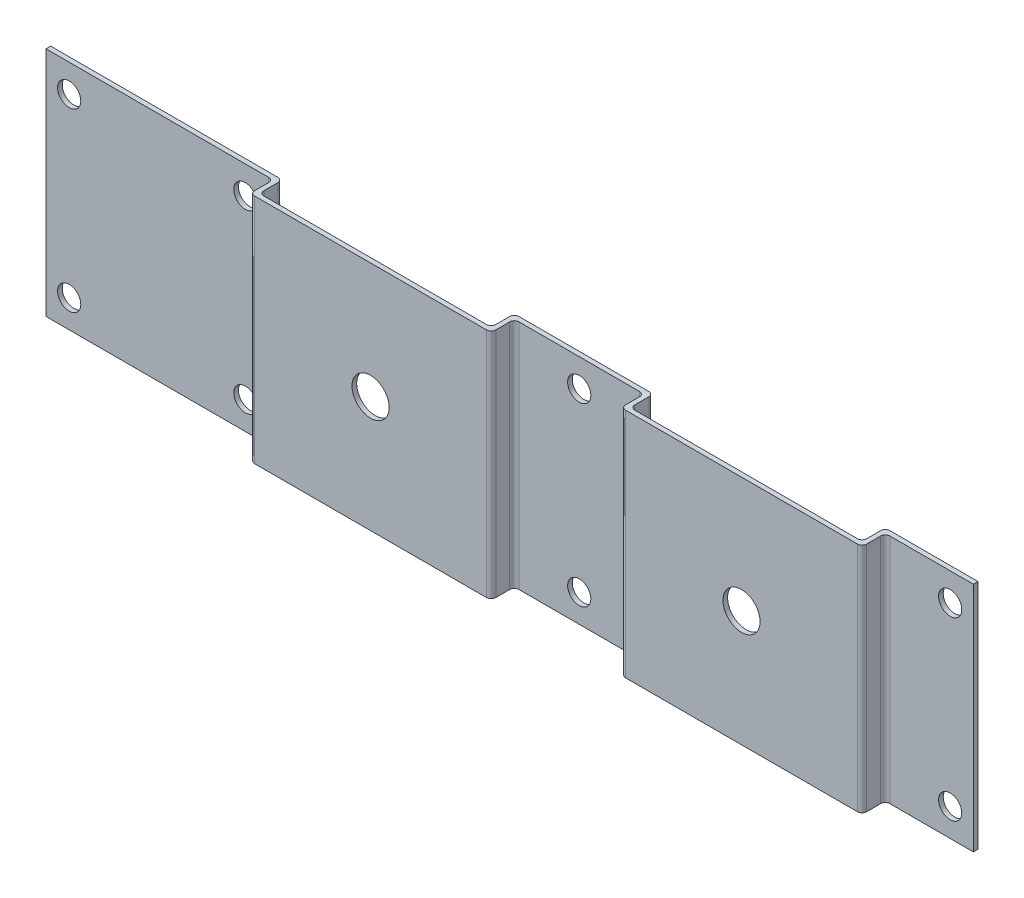
from build123d import *

# Parameters (mm, degrees)
SKETCH1_W           = 50
SKETCH1_H           = 50
BOSS_EXTRUDE1_DEPTH = 1
BOSS_EXTRUDE2_START = 5
SKETCH2_W           = 50
SKETCH2_H           = 50
BOSS_EXTRUDE2_DEPTH = 1
SKETCH3_W           = 30
SKETCH3_H           = 50
BOSS_EXTRUDE3_DEPTH = 1
BOSS_EXTRUDE4_START = 5
SKETCH4_W           = 50
SKETCH4_H           = 50
BOSS_EXTRUDE4_DEPTH = 1
SKETCH5_W           = 20
SKETCH5_H           = 50
BOSS_EXTRUDE5_DEPTH = 1
SKETCH6_W           = 6
SKETCH6_H           = 50
BOSS_EXTRUDE6_DEPTH = 1
SKETCH7_W           = 6
SKETCH7_H           = 50
BOSS_EXTRUDE7_DEPTH = 1
SKETCH8_W           = 6
SKETCH8_H           = 50
BOSS_EXTRUDE8_DEPTH = 1
SKETCH9_W           = 6
SKETCH9_H           = 50
BOSS_EXTRUDE9_DEPTH = 1
FILLET1_R           = 1
FILLET2_R           = 1
FILLET3_R           = 1
FILLET4_R           = 1
FILLET5_R           = 1
FILLET6_R           = 1
FILLET7_R           = 1
FILLET8_R           = 1
FILLET9_R           = 1
FILLET10_R          = 1
FILLET11_R          = 1
FILLET12_R          = 1
FILLET13_R          = 1
FILLET14_R          = 1
FILLET15_R          = 1
FILLET16_R          = 1
SKETCH10_R          = 2.5
CUT_EXTRUDE1_DEPTH  = 1
SKETCH11_R          = 4
SKETCH11_R_2        = 2.5
CUT_EXTRUDE7_DEPTH  = 50.5


with BuildPart() as part:
    # Sketch1 → Boss-Extrude1 (new body)
    with BuildSketch(Plane.XY):
        Rectangle(SKETCH1_W, SKETCH1_H)
    extrude(amount=BOSS_EXTRUDE1_DEPTH)



with BuildPart() as body_2:
    # Sketch2 → Boss-Extrude2 (new body)
    with BuildSketch(Plane.XY.offset(BOSS_EXTRUDE2_START)):
        with Locations((50, 0)):
            Rectangle(SKETCH2_W, SKETCH2_H)
    extrude(amount=BOSS_EXTRUDE2_DEPTH)


with BuildPart() as body_3:
    # Sketch3 → Boss-Extrude3 (new body)
    with BuildSketch(Plane.XY):
        with Locations((90, 0)):
            Rectangle(SKETCH3_W, SKETCH3_H)
    extrude(amount=BOSS_EXTRUDE3_DEPTH)


with BuildPart() as body_4:
    # Sketch4 → Boss-Extrude4 (new body)
    with BuildSketch(Plane.XY.offset(BOSS_EXTRUDE4_START)):
        with Locations((130, 0)):
            Rectangle(SKETCH4_W, SKETCH4_H)
    extrude(amount=BOSS_EXTRUDE4_DEPTH)


with BuildPart() as body_5:
    # Sketch5 → Boss-Extrude5 (new body)
    with BuildSketch(Plane.XY):
        with Locations((165, 0)):
            Rectangle(SKETCH5_W, SKETCH5_H)
    extrude(amount=BOSS_EXTRUDE5_DEPTH)


with BuildPart() as part_1:
    add(part.part)

    add(body_2.part)  # Boss-Extrude6 merges body 2
    # Sketch6 → Boss-Extrude6 (add)
    with BuildSketch(Plane.ZY.offset(-25)):
        with Locations((3, 0)):
            Rectangle(SKETCH6_W, SKETCH6_H)
    extrude(amount=BOSS_EXTRUDE6_DEPTH)


    add(body_3.part)  # Boss-Extrude7 merges body 3
    # Sketch7 → Boss-Extrude7 (add)
    with BuildSketch(Plane(origin=(75, 0, 0), x_dir=(0, 0, -1), z_dir=(1, 0, 0))):
        with Locations((-3, 0)):
            Rectangle(SKETCH7_W, SKETCH7_H)
    extrude(amount=BOSS_EXTRUDE7_DEPTH)


    add(body_4.part)  # Boss-Extrude8 merges body 4
    # Sketch8 → Boss-Extrude8 (add)
    with BuildSketch(Plane.ZY.offset(-105)):
        with Locations((3, 0)):
            Rectangle(SKETCH8_W, SKETCH8_H)
    extrude(amount=BOSS_EXTRUDE8_DEPTH)


    add(body_5.part)  # Boss-Extrude9 merges body 5
    # Sketch9 → Boss-Extrude9 (add)
    with BuildSketch(Plane(origin=(155, 0, 0), x_dir=(0, 0, -1), z_dir=(1, 0, 0))):
        with Locations((-3, 0)):
            Rectangle(SKETCH9_W, SKETCH9_H)
    extrude(amount=BOSS_EXTRUDE9_DEPTH)

    # Fillet1
    fillet1_edges = [part_1.edges().sort_by_distance(p)[0] for p in [
        (24, 0, 1),
    ]]
    fillet(fillet1_edges, radius=FILLET1_R)

    # Fillet2
    fillet2_edges = [part_1.edges().sort_by_distance(p)[0] for p in [
        (24, 0, 6),
    ]]
    fillet(fillet2_edges, radius=FILLET2_R)

    # Fillet3
    fillet3_edges = [part_1.edges().sort_by_distance(p)[0] for p in [
        (76, 0, 6),
    ]]
    fillet(fillet3_edges, radius=FILLET3_R)

    # Fillet4
    fillet4_edges = [part_1.edges().sort_by_distance(p)[0] for p in [
        (76, 0, 1),
    ]]
    fillet(fillet4_edges, radius=FILLET4_R)

    # Fillet5
    fillet5_edges = [part_1.edges().sort_by_distance(p)[0] for p in [
        (104, 0, 6),
    ]]
    fillet(fillet5_edges, radius=FILLET5_R)

    # Fillet6
    fillet6_edges = [part_1.edges().sort_by_distance(p)[0] for p in [
        (104, 0, 1),
    ]]
    fillet(fillet6_edges, radius=FILLET6_R)

    # Fillet7
    fillet7_edges = [part_1.edges().sort_by_distance(p)[0] for p in [
        (156, 0, 6),
    ]]
    fillet(fillet7_edges, radius=FILLET7_R)

    # Fillet8
    fillet8_edges = [part_1.edges().sort_by_distance(p)[0] for p in [
        (156, 0, 1),
    ]]
    fillet(fillet8_edges, radius=FILLET8_R)

    # Fillet9
    fillet9_edges = [part_1.edges().sort_by_distance(p)[0] for p in [
        (155, 0, 0),
    ]]
    fillet(fillet9_edges, radius=FILLET9_R)

    # Fillet10
    fillet10_edges = [part_1.edges().sort_by_distance(p)[0] for p in [
        (155, 0, 5),
    ]]
    fillet(fillet10_edges, radius=FILLET10_R)

    # Fillet11
    fillet11_edges = [part_1.edges().sort_by_distance(p)[0] for p in [
        (105, 0, 5),
    ]]
    fillet(fillet11_edges, radius=FILLET11_R)

    # Fillet12
    fillet12_edges = [part_1.edges().sort_by_distance(p)[0] for p in [
        (105, 0, 0),
    ]]
    fillet(fillet12_edges, radius=FILLET12_R)

    # Fillet13
    fillet13_edges = [part_1.edges().sort_by_distance(p)[0] for p in [
        (25, 0, 5),
    ]]
    fillet(fillet13_edges, radius=FILLET13_R)

    # Fillet14
    fillet14_edges = [part_1.edges().sort_by_distance(p)[0] for p in [
        (25, 0, 0),
    ]]
    fillet(fillet14_edges, radius=FILLET14_R)

    # Fillet15
    fillet15_edges = [part_1.edges().sort_by_distance(p)[0] for p in [
        (75, 0, 5),
    ]]
    fillet(fillet15_edges, radius=FILLET15_R)

    # Fillet16
    fillet16_edges = [part_1.edges().sort_by_distance(p)[0] for p in [
        (75, 0, 0),
    ]]
    fillet(fillet16_edges, radius=FILLET16_R)

    # Sketch10 → Cut-Extrude1 (cut)
    with BuildSketch(Plane.XY.offset(1)):
        with Locations((-20, 19)):
            Circle(SKETCH10_R)
        with Locations((-20, -19)):
            Circle(SKETCH10_R)
        with Locations((18, -19)):
            Circle(SKETCH10_R)
        with Locations((18, 19)):
            Circle(SKETCH10_R)
    extrude(amount=-CUT_EXTRUDE1_DEPTH, mode=Mode.SUBTRACT)

    # Sketch11 → Cut-Extrude7 (cut, symmetric)
    with BuildSketch(Plane.XY):
        with Locations(Location((50, 0, 0), (0, 0, 180))):
            Circle(SKETCH11_R)
        with Locations(Location((130, 0, 0), (0, 0, 180))):
            Circle(SKETCH11_R)
        with Locations(Location((90, 19, 0), (0, 0, 180))):
            Circle(SKETCH11_R_2)
        with Locations(Location((90, -19, 0), (0, 0, 180))):
            Circle(SKETCH11_R_2)
        with Locations(Location((170, 19, 0), (0, 0, 180))):
            Circle(SKETCH11_R_2)
        with Locations(Location((170, -19, 0), (0, 0, 180))):
            Circle(SKETCH11_R_2)
    extrude(amount=CUT_EXTRUDE7_DEPTH, both=True, mode=Mode.SUBTRACT)


solid = part_1.part
